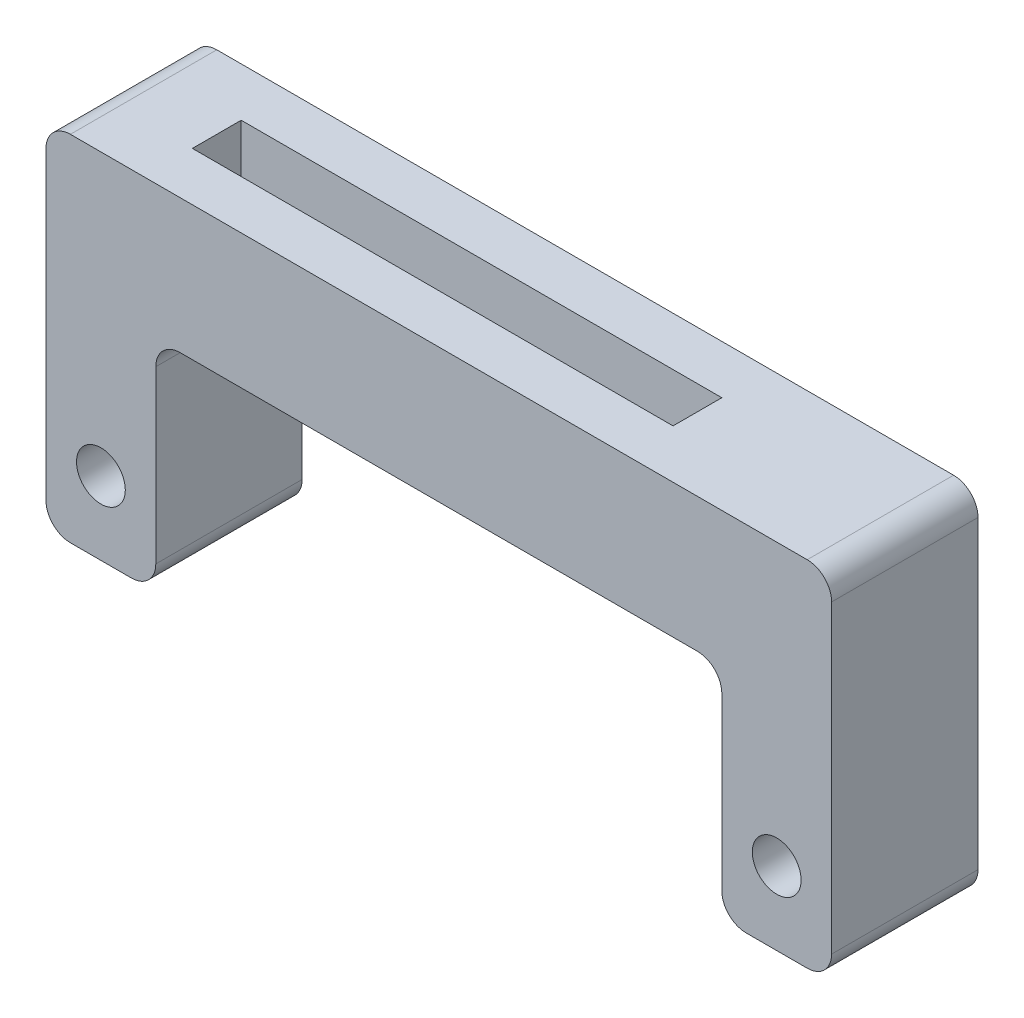
from build123d import *

# Parameters (mm, degrees)
SKETCH2_W           = 32.2
SKETCH2_H           = 14.5
BOSS_EXTRUDE1_DEPTH = 3
SKETCH3_W           = 19.7
SKETCH3_H           = 2
CUT_EXTRUDE1_DEPTH  = 2.5
SKETCH4_W           = 23.2
SKETCH4_H           = 9
CUT_EXTRUDE2_DEPTH  = 19.648659469
SKETCH5_R           = 1
CUT_EXTRUDE3_DEPTH  = 19.648659469
FILLET1_R           = 1


with BuildPart() as part:
    # Sketch2 → Boss-Extrude1 (new, symmetric)
    with BuildSketch(Plane.XY):
        Rectangle(SKETCH2_W, SKETCH2_H)
    extrude(amount=BOSS_EXTRUDE1_DEPTH, both=True)

    # Sketch3 → Cut-Extrude1 (cut)
    with BuildSketch(Plane(origin=(0, 7.25, 0), x_dir=(1, 0, 0), z_dir=(0, 1, 0))):
        with Locations((-2.25, 0)):
            Rectangle(SKETCH3_W, SKETCH3_H)
    extrude(amount=-CUT_EXTRUDE1_DEPTH, mode=Mode.SUBTRACT)

    # Sketch4 → Cut-Extrude2 (cut, through all)
    with BuildSketch(Plane.XY.offset(3)):
        with Locations((0, -2.75)):
            Rectangle(SKETCH4_W, SKETCH4_H)
    extrude(amount=-CUT_EXTRUDE2_DEPTH, mode=Mode.SUBTRACT)

    # Sketch5 → Cut-Extrude3 (cut, through all)
    with BuildSketch(Plane.XY.offset(3)):
        with Locations((-13.85, -4.25)):
            Circle(SKETCH5_R)
        with Locations((13.85, -4.25)):
            Circle(SKETCH5_R)
    extrude(amount=-CUT_EXTRUDE3_DEPTH, mode=Mode.SUBTRACT)

    # Fillet1
    fillet1_edges = [part.edges().sort_by_distance(p)[0] for p in [
        (-11.6, -7.25, 0),
        (-11.6, 1.75, 0),
        (11.6, 1.75, 0),
        (11.6, -7.25, 0),
        (16.1, -7.25, 0),
        (-16.1, -7.25, 0),
        (-16.1, 7.25, 0),
        (16.1, 7.25, 0),
    ]]
    fillet(fillet1_edges, radius=FILLET1_R)


solid = part.part
